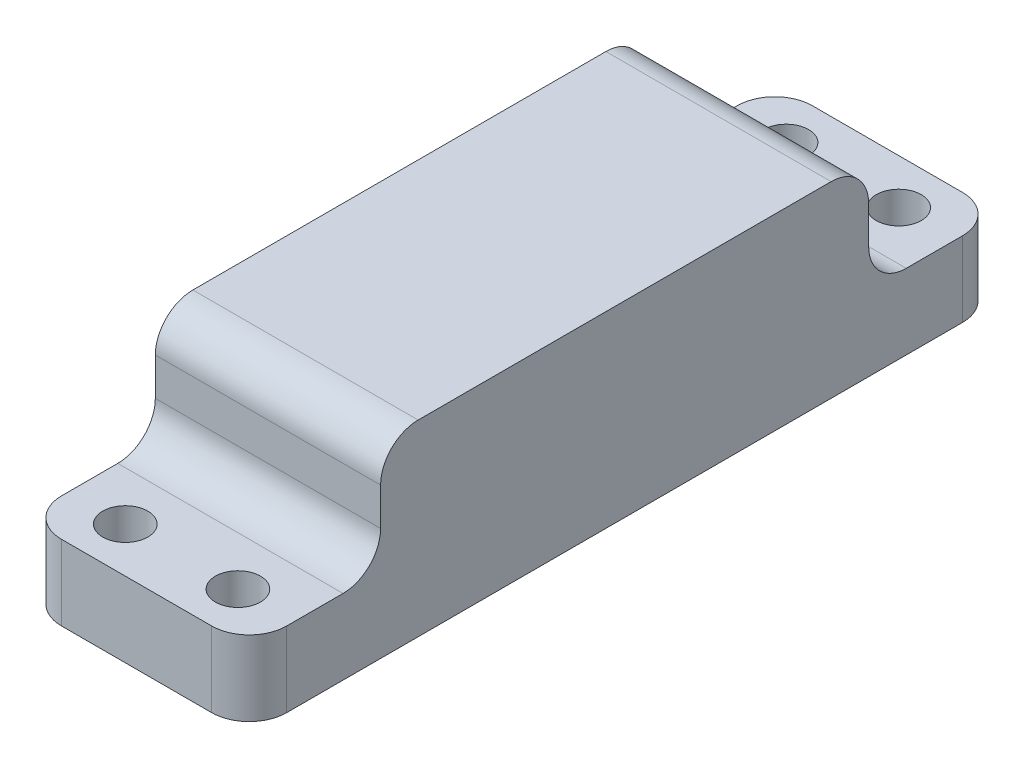
from build123d import *

# Parameters (mm, degrees)
BOSS_EXTRUDE1_DEPTH                     = 60
CBORE_FOR_M5_HEX_HEAD_BOLT1_D           = 8
CBORE_FOR_M5_HEX_HEAD_BOLT1_CBORE_D     = 12
CBORE_FOR_M5_HEX_HEAD_BOLT1_CBORE_DEPTH = 10
FILLET1_R                               = 10
FILLET2_R                               = 10
FILLET3_R                               = 10
FILLET4_R                               = 10


with BuildPart() as part:
    # Sketch2 → Boss-Extrude1 (new body)
    with BuildSketch(Plane(origin=(0, 0, 0), x_dir=(0, 0, -1), z_dir=(1, 0, 0))):
        with BuildLine():
            Line((0, 0), (0, 20))
            Line((0, 20), (25, 20))
            ThreePointArc((25, 20), (32.071067812, 22.928932188), (35, 30))
            Line((35, 30), (35, 40))
            ThreePointArc((35, 40), (37.928932188, 47.071067812), (45, 50))
            Line((45, 50), (155, 50))
            ThreePointArc((155, 50), (162.071067812, 47.071067812), (165, 40))
            Line((165, 40), (165, 30))
            ThreePointArc((165, 30), (167.928932188, 22.928932188), (175, 20))
            Line((175, 20), (200, 20))
            Line((200, 20), (200, 0))
            Line((200, 0), (0, 0))
        make_face()
    extrude(amount=-BOSS_EXTRUDE1_DEPTH)

    # CBORE for M5 Hex Head Bolt1 (through all)
    with Locations(Plane(origin=(0, 20, 0), x_dir=(1, 0, 0), z_dir=(0, 1, 0))):
        with Locations((-15, 12), (-45, 12), (-45, 188), (-15, 188)):
            CounterBoreHole(CBORE_FOR_M5_HEX_HEAD_BOLT1_D / 2, CBORE_FOR_M5_HEX_HEAD_BOLT1_CBORE_D / 2, CBORE_FOR_M5_HEX_HEAD_BOLT1_CBORE_DEPTH)

    # Fillet1
    fillet1_edges = [part.edges().sort_by_distance(p)[0] for p in [
        (-60, 10, -200),
    ]]
    fillet(fillet1_edges, radius=FILLET1_R)

    # Fillet2
    fillet2_edges = [part.edges().sort_by_distance(p)[0] for p in [
        (0, 10, -200),
    ]]
    fillet(fillet2_edges, radius=FILLET2_R)

    # Fillet3
    fillet3_edges = [part.edges().sort_by_distance(p)[0] for p in [
        (0, 10, 0),
    ]]
    fillet(fillet3_edges, radius=FILLET3_R)

    # Fillet4
    fillet4_edges = [part.edges().sort_by_distance(p)[0] for p in [
        (-60, 10, 0),
    ]]
    fillet(fillet4_edges, radius=FILLET4_R)


solid = part.part
